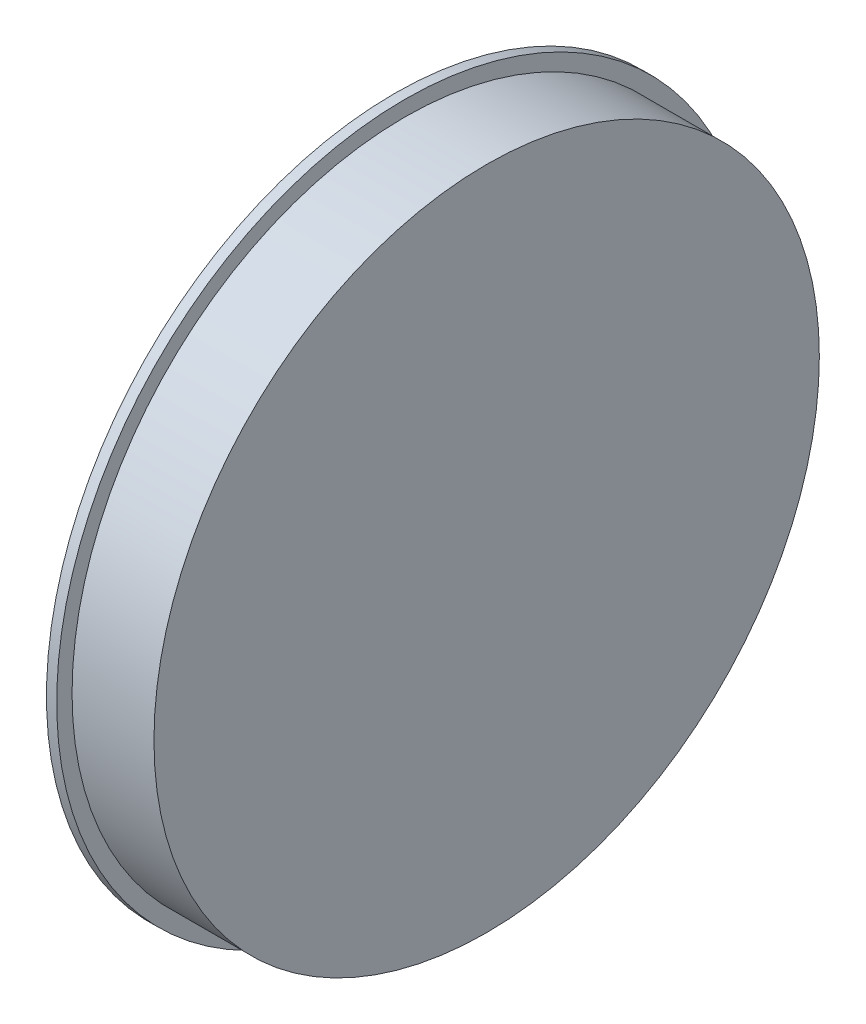
from build123d import *


with BuildPart() as part:
    # Sketch1 → Revolve1 (revolve)
    with BuildSketch(Plane.XY):
        Polygon((0, 0), (0, 34), (1, 34), (1, 32.5), (9, 32.5), (9, 0), align=None)
    revolve(axis=Axis((9, 0, 0), (-1, 0, 0)))


solid = part.part
